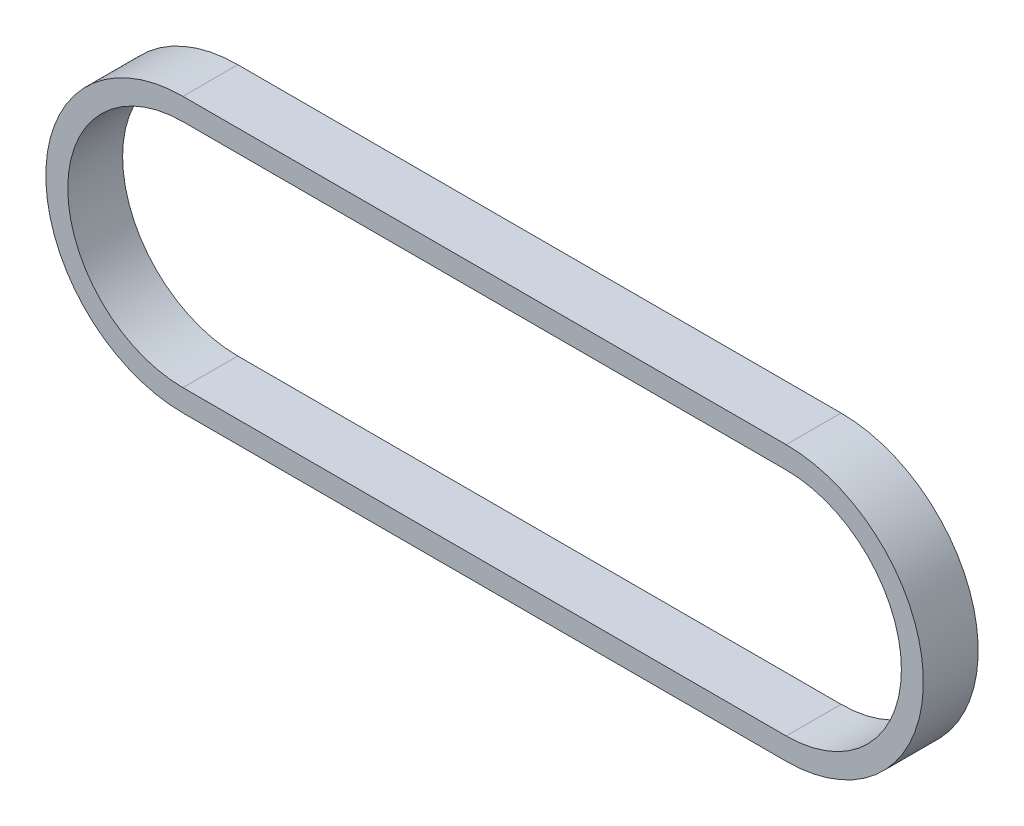
from build123d import *

# Parameters (mm, degrees)
BOSS_EXTRUDE1_DEPTH = 10


with BuildPart() as part:
    # Sketch3 → Boss-Extrude1 (new body)
    with BuildSketch(Plane.XY):
        with BuildLine():
            Line((0, -25), (-110, -25))
            ThreePointArc((-110, -25), (-135, 0), (-110, 25))
            Line((-110, 25), (0, 25))
            ThreePointArc((0, 25), (25, 0), (0, -25))
        make_face()
        with BuildLine():
            Line((0, -21), (-110, -21))
            ThreePointArc((-110, -21), (-131, 0), (-110, 21))
            Line((-110, 21), (0, 21))
            ThreePointArc((0, 21), (21, 0), (0, -21))
        make_face(mode=Mode.SUBTRACT)
    extrude(amount=BOSS_EXTRUDE1_DEPTH)


solid = part.part
